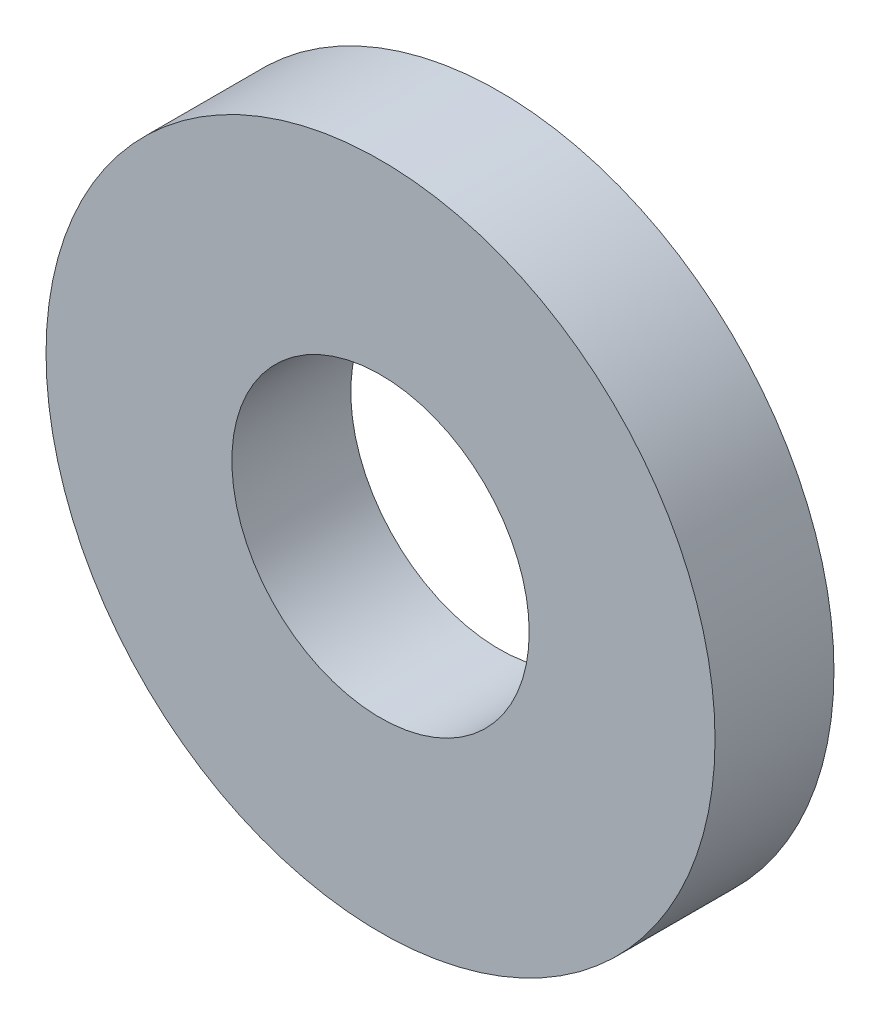
from build123d import *

# Parameters (mm, degrees)
IZIM1_R                     = 22.5
IZIM1_R_2                   = 10
Y_KSEKLIK_EKSTR_ZYON1_DEPTH = 8


with BuildPart() as part:
    # Çizim1 → Yükseklik-Ekstrüzyon1 (new body)
    with BuildSketch(Plane.XY):
        Circle(IZIM1_R)
        Circle(IZIM1_R_2, mode=Mode.SUBTRACT)
    extrude(amount=Y_KSEKLIK_EKSTR_ZYON1_DEPTH)


solid = part.part
